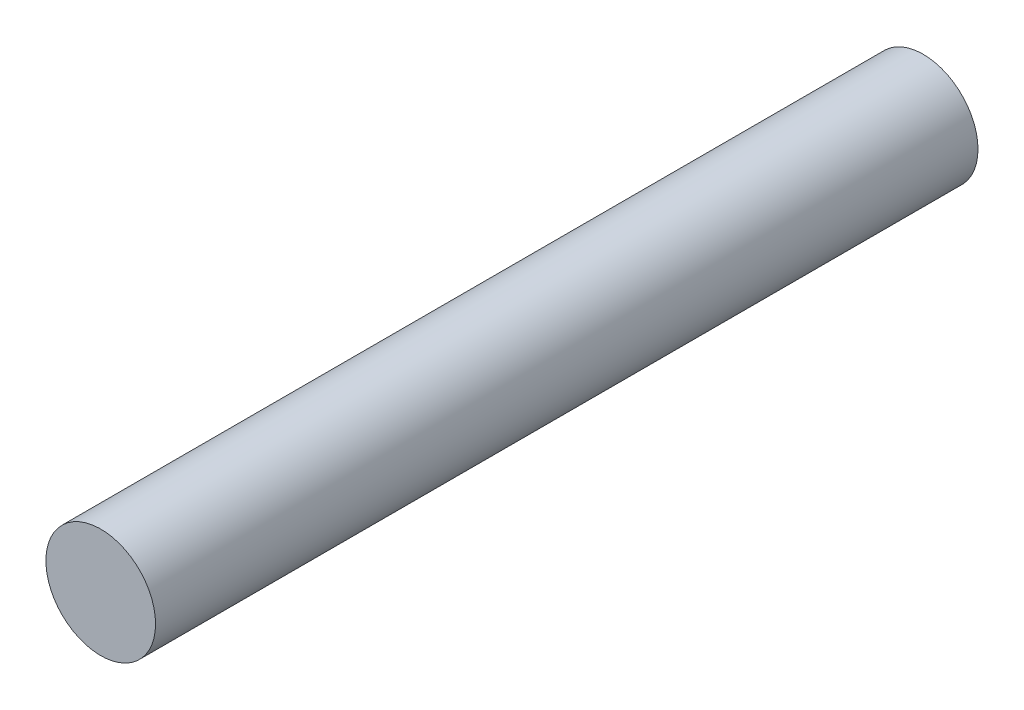
from build123d import *

# Parameters (mm, degrees)
SKETCH1_R           = 5
BOSS_EXTRUDE1_DEPTH = 75


with BuildPart() as part:
    # Sketch1 → Boss-Extrude1 (new body)
    with BuildSketch(Plane.XY):
        Circle(SKETCH1_R)
    extrude(amount=BOSS_EXTRUDE1_DEPTH)


solid = part.part
